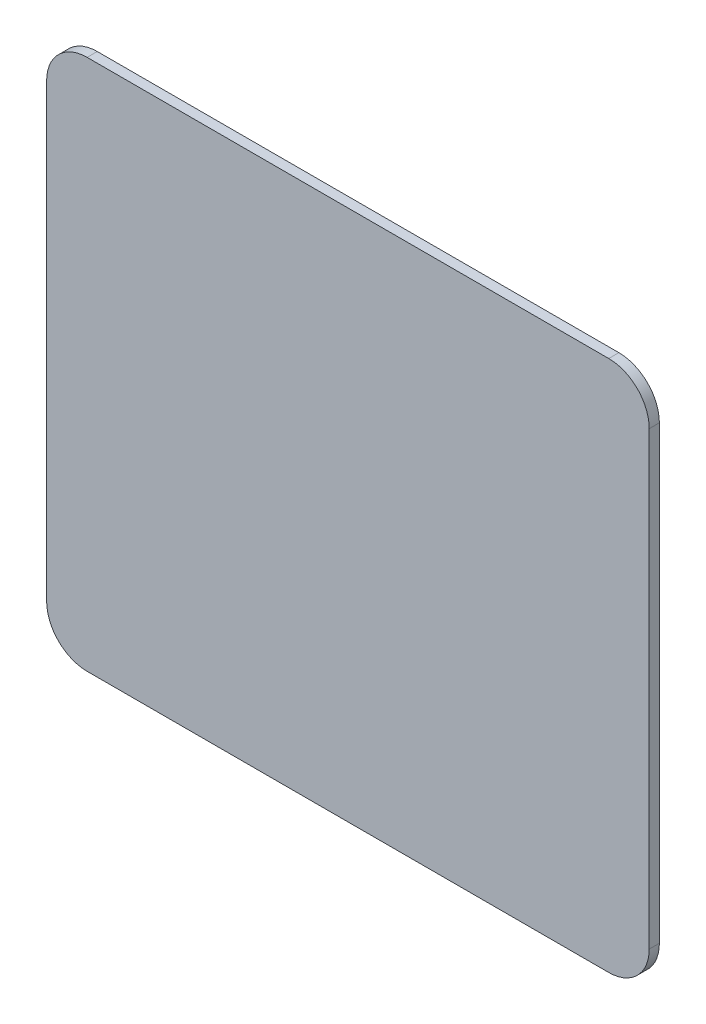
from build123d import *

# Parameters (mm, degrees)
SKETCH1_W           = 377.952
SKETCH1_H           = 333.502
BOSS_EXTRUDE1_DEPTH = 6.35
FILLET1_R           = 25.4
FILLET2_R           = 25.4
FILLET3_R           = 25.4
FILLET4_R           = 25.4


with BuildPart() as part:
    # Sketch1 → Boss-Extrude1 (new body)
    with BuildSketch(Plane.XY):
        with Locations((188.976, -166.751)):
            Rectangle(SKETCH1_W, SKETCH1_H)
    extrude(amount=BOSS_EXTRUDE1_DEPTH)

    # Fillet1
    fillet1_edges = [part.edges().sort_by_distance(p)[0] for p in [
        (377.952, 0, 3.175),
    ]]
    fillet(fillet1_edges, radius=FILLET1_R)

    # Fillet2
    fillet2_edges = [part.edges().sort_by_distance(p)[0] for p in [
        (377.952, -333.502, 3.175),
    ]]
    fillet(fillet2_edges, radius=FILLET2_R)

    # Fillet3
    fillet3_edges = [part.edges().sort_by_distance(p)[0] for p in [
        (0, -333.502, 3.175),
    ]]
    fillet(fillet3_edges, radius=FILLET3_R)

    # Fillet4
    fillet4_edges = [part.edges().sort_by_distance(p)[0] for p in [
        (0, 0, 3.175),
    ]]
    fillet(fillet4_edges, radius=FILLET4_R)


solid = part.part
